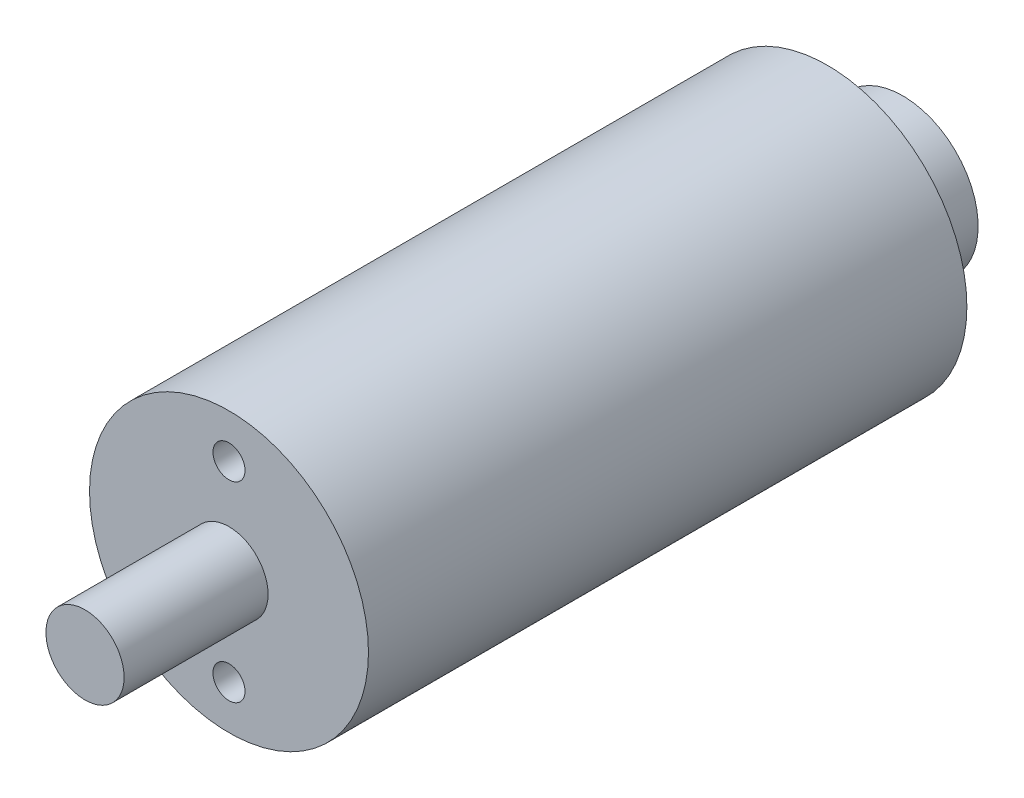
from build123d import *

# Parameters (mm, degrees)
SKETCH1_R           = 12.4
BOSS_EXTRUDE1_DEPTH = 53.2
SKETCH2_R           = 3.475
BOSS_EXTRUDE2_DEPTH = 12.8
SKETCH3_R           = 1.425
CUT_EXTRUDE1_DEPTH  = 5
SKETCH4_R           = 6.7
BOSS_EXTRUDE3_DEPTH = 6.7


with BuildPart() as part:
    # Sketch1 → Boss-Extrude1 (new body)
    with BuildSketch(Plane.XY):
        Circle(SKETCH1_R)
    extrude(amount=-BOSS_EXTRUDE1_DEPTH)

    # Sketch2 → Boss-Extrude2 (add)
    with BuildSketch(Plane.XY):
        Circle(SKETCH2_R)
    extrude(amount=BOSS_EXTRUDE2_DEPTH)

    # Sketch3 → Cut-Extrude1 (cut)
    with BuildSketch(Plane.XY):
        with Locations((0, 8.5)):
            Circle(SKETCH3_R)
        with Locations((0, -8.5)):
            Circle(SKETCH3_R)
    extrude(amount=-CUT_EXTRUDE1_DEPTH, mode=Mode.SUBTRACT)

    # Sketch4 → Boss-Extrude3 (add)
    with BuildSketch(Plane(origin=(0, 0, -53.2), x_dir=(-1, 0, 0), z_dir=(0, 0, -1))):
        Circle(SKETCH4_R)
    extrude(amount=BOSS_EXTRUDE3_DEPTH)


solid = part.part
